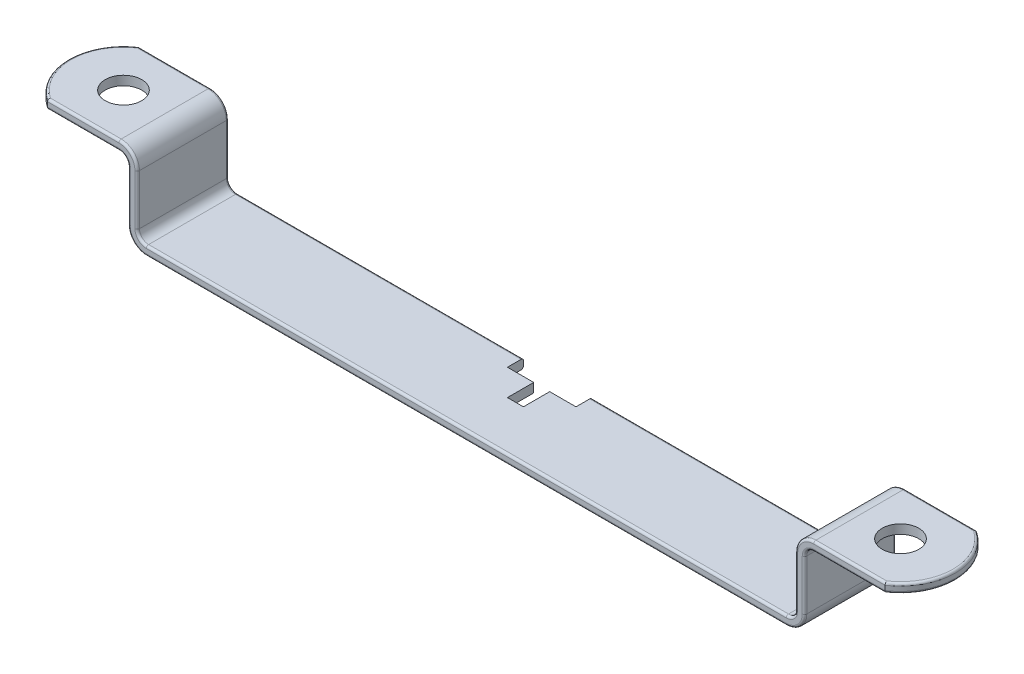
from build123d import *

# Parameters (mm, degrees)
BOSS_EXTRUDE1_DEPTH = 10
SKETCH2_R           = 4
CUT_EXTRUDE1_DEPTH  = 100.347873656
CUT_EXTRUDE2_DEPTH  = 99.984847325
FILLET1_R           = 2
FILLET2_R           = 4
FILLET3_R           = 0.5


with BuildPart() as part:
    # Sketch1 → Boss-Extrude1 (new, symmetric)
    with BuildSketch(Plane.XY):
        Polygon((0, 0), (-74, 0), (-74, 17), (-97, 17), (-97, 19), (-72, 19), (-72, 2), (72, 2), (72, 19), (97, 19), (97, 17), (74, 17), (74, 0), align=None)
    extrude(amount=BOSS_EXTRUDE1_DEPTH, both=True)

    # Sketch2 → Cut-Extrude1 (cut, through all)
    with BuildSketch(Plane(origin=(0, 19, 0), x_dir=(1, 0, 0), z_dir=(0, 1, 0))):
        with BuildLine():
            ThreePointArc((-97, 0), (-95.573528147, 5.674548662), (-91.633249581, 10))
            Line((-91.633249581, 10), (-97, 10))
            Line((-97, 10), (-97, 0))
        make_face()
        with BuildLine():
            ThreePointArc((-91.633249581, -10), (-95.573528147, -5.674548662), (-97, 0))
            Line((-97, 0), (-97, -10))
            Line((-97, -10), (-91.633249581, -10))
        make_face()
        with Locations(Location((-85, 0, 0), (0, 0, 270))):
            Circle(SKETCH2_R)
    cut_extrude1 = extrude(amount=-CUT_EXTRUDE1_DEPTH, mode=Mode.SUBTRACT)

    # Mirror1: Cut-Extrude1 across plane
    add(cut_extrude1.mirror(Plane(origin=(0, 0, 0), x_dir=(0, 0, 1), z_dir=(1, 0, 0))), mode=Mode.SUBTRACT)

    # Sketch3 → Cut-Extrude2 (cut, through all)
    with BuildSketch(Plane(origin=(0, 2, 0), x_dir=(1, 0, 0), z_dir=(0, 1, 0))):
        Polygon((-7.5, 6.5), (-1.75, 6.5), (-1.75, 0.75), (1.75, 0.75), (1.75, 6.5), (7.5, 6.5), (7.5, 10), (-7.5, 10), align=None)
    extrude(amount=-CUT_EXTRUDE2_DEPTH, mode=Mode.SUBTRACT)

    # Fillet1
    fillet1_edges = [part.edges().sort_by_distance(p)[0] for p in [
        (-74, 17, 0),
        (-72, 2, 0),
        (72, 2, 0),
        (74, 17, 0),
    ]]
    fillet(fillet1_edges, radius=FILLET1_R)

    # Fillet2
    fillet2_edges = [part.edges().sort_by_distance(p)[0] for p in [
        (-74, 0, 0),
        (-72, 19, 0),
        (72, 19, 0),
        (74, 0, 0),
    ]]
    fillet(fillet2_edges, radius=FILLET2_R)

    # Fillet3
    fillet3_edges = [part.edges().sort_by_distance(p)[0] for p in [
        (-74, 9.5, -10),
        (-74, 9.5, 10),
        (-72, 9.5, -10),
        (-73.171572875, 17.828427125, -10),
        (-71.414213562, 2.585786438, -10),
        (-83.81662479, 19, -10),
        (-38.75, 2, -10),
        (-83.81662479, 17, -10),
        (-38.75, 0, -10),
        (-74.585786438, 16.414213562, -10),
        (-72.828427125, 1.171572875, -10),
        (-72.828427125, 1.171572875, 10),
        (-74.585786438, 16.414213562, 10),
        (74, 9.5, 10),
        (72.828427125, 1.171572875, 10),
        (74.585786438, 16.414213562, 10),
        (0, 0, 10),
        (83.81662479, 17, 10),
        (83.81662479, 19, 10),
        (73.171572875, 17.828427125, 10),
        (-83.81662479, 17, 10),
        (72, 9.5, 10),
        (71.414213562, 2.585786438, 10),
        (-83.81662479, 19, 10),
        (0, 2, 10),
        (-73.171572875, 17.828427125, 10),
        (-71.414213562, 2.585786438, 10),
        (-72, 9.5, 10),
        (-97, 19, 0),
        (38.75, 2, -10),
        (-97, 17, 0),
        (38.75, 0, -10),
        (74, 9.5, -10),
        (72.828427125, 1.171572875, -10),
        (74.585786438, 16.414213562, -10),
        (83.81662479, 17, -10),
        (97, 17, 0),
        (97, 19, 0),
        (83.81662479, 19, -10),
        (73.171572875, 17.828427125, -10),
        (72, 9.5, -10),
        (71.414213562, 2.585786438, -10),
    ]]
    fillet(fillet3_edges, radius=FILLET3_R)


solid = part.part
